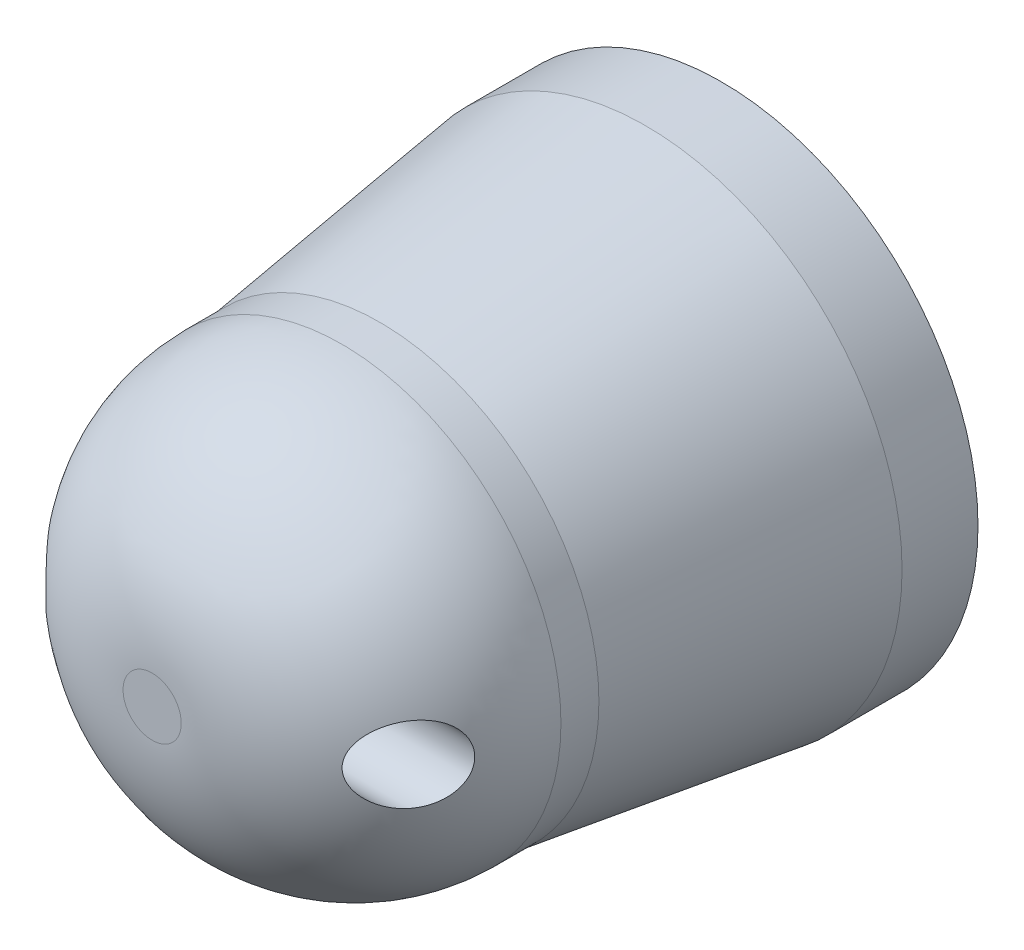
from build123d import *

# Parameters (mm, degrees)
F_6_0MM_DOWEL_HOLE1_D     = 6
F_6_0MM_DOWEL_HOLE1_DEPTH = 9
F_6_0MM_DOWEL_HOLE1_TIP   = 1.802581857
CUT_EXTRUDE1_DEPTH        = 10
CUT_EXTRUDE1_DEPTH_BACK   = 10
SKETCH4_R                 = 1


with BuildPart() as part:
    # Sketch1 → Revolve1 (revolve)
    with BuildSketch(Plane(origin=(0, 0, 0), x_dir=(1, 0, 0), z_dir=(0, 1, 0))):
        with BuildLine():
            Line((0, 0), (-0.766214157, 0))
            ThreePointArc((-0.766214157, 0), (-4.301748063, 1.464466094), (-5.766214157, 5))
            Line((-5.766214157, 5), (-5.766214157, 6))
            Line((-5.766214157, 6), (-6.75, 13))
            Line((-6.75, 13), (-6.75, 15))
            Line((-6.75, 15), (0, 15))
            Line((0, 15), (0, 0))
        make_face()
    revolve(axis=Axis((0, 0, 0), (0, 0, -1)))

    # Ø6.0mm Dowel Hole1
    with Locations(Plane(origin=(0, 0, -15), x_dir=(-1, 0, 0), z_dir=(0, 0, -1))):
        with Locations((0, 0)):
            Hole(F_6_0MM_DOWEL_HOLE1_D / 2, depth=F_6_0MM_DOWEL_HOLE1_DEPTH)
            with Locations((0, 0, -(F_6_0MM_DOWEL_HOLE1_DEPTH + F_6_0MM_DOWEL_HOLE1_TIP / 2))):  # 118° drill point
                Cone(0, F_6_0MM_DOWEL_HOLE1_D / 2, F_6_0MM_DOWEL_HOLE1_TIP, mode=Mode.SUBTRACT)

    # Sketch4 → Cut-Extrude1 (cut, two sides: drawn at the far end of the back side and taken through both)
    with BuildSketch(Plane(origin=(0, 0, 0), x_dir=(0, 0, -1), z_dir=(1, 0, 0)).offset(-CUT_EXTRUDE1_DEPTH_BACK)):
        with Locations((2.103245374, 0)):
            Circle(SKETCH4_R)
    extrude(amount=CUT_EXTRUDE1_DEPTH + CUT_EXTRUDE1_DEPTH_BACK, mode=Mode.SUBTRACT)


solid = part.part
